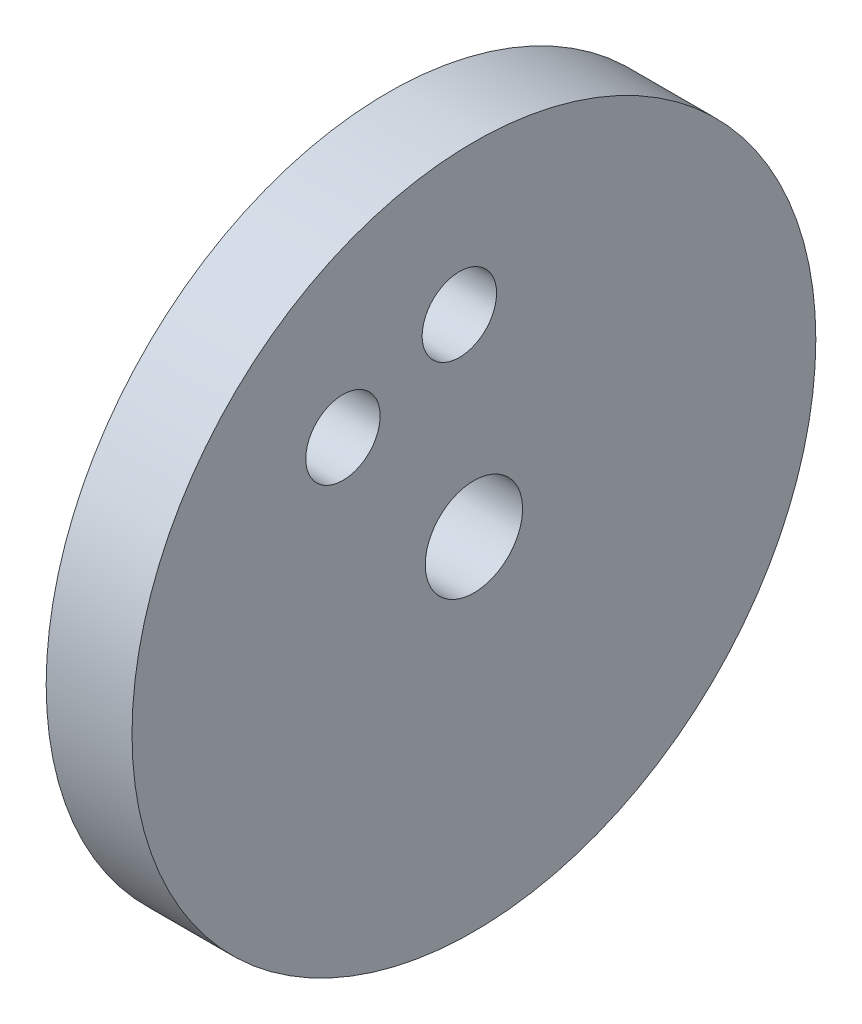
from build123d import *

# Parameters (mm, degrees)
AXIAL_PROFILE_MM_W     = 6
AXIAL_PROFILE_MM_H     = 20.5
AXIAL_HOLES_DEPTH      = 86.926829338
AXIAL_HOLES_DEPTH_BACK = 86.926829338
SKETCH2_R              = 2.6


with BuildPart() as part:
    # Axial profile (mm) → Full revolution (revolve)
    with BuildSketch(Plane.XY, mode=Mode.PRIVATE) as full_revolution_sk:
        with Locations((76, 13.65)):
            Rectangle(AXIAL_PROFILE_MM_W, AXIAL_PROFILE_MM_H)
    revolve(full_revolution_sk.sketch.rotate(Axis((-110, 0, 0), (1, 0, 0)), 90), axis=Axis((-110, 0, 0), (1, 0, 0)))

    # Sketch2 → Axial holes (cut, two sides: drawn at the far end of the back side and taken through both)
    with BuildSketch(Plane(origin=(0, 0, 0), x_dir=(0, 0, -1), z_dir=(1, 0, 0)).offset(-AXIAL_HOLES_DEPTH_BACK)):
        with Locations((-1.016890853, 13.963020196)):
            Circle(SKETCH2_R)
        with Locations((-9.154295848, 10.592396684)):
            Circle(SKETCH2_R)
    extrude(amount=AXIAL_HOLES_DEPTH + AXIAL_HOLES_DEPTH_BACK, mode=Mode.SUBTRACT)


solid = part.part
